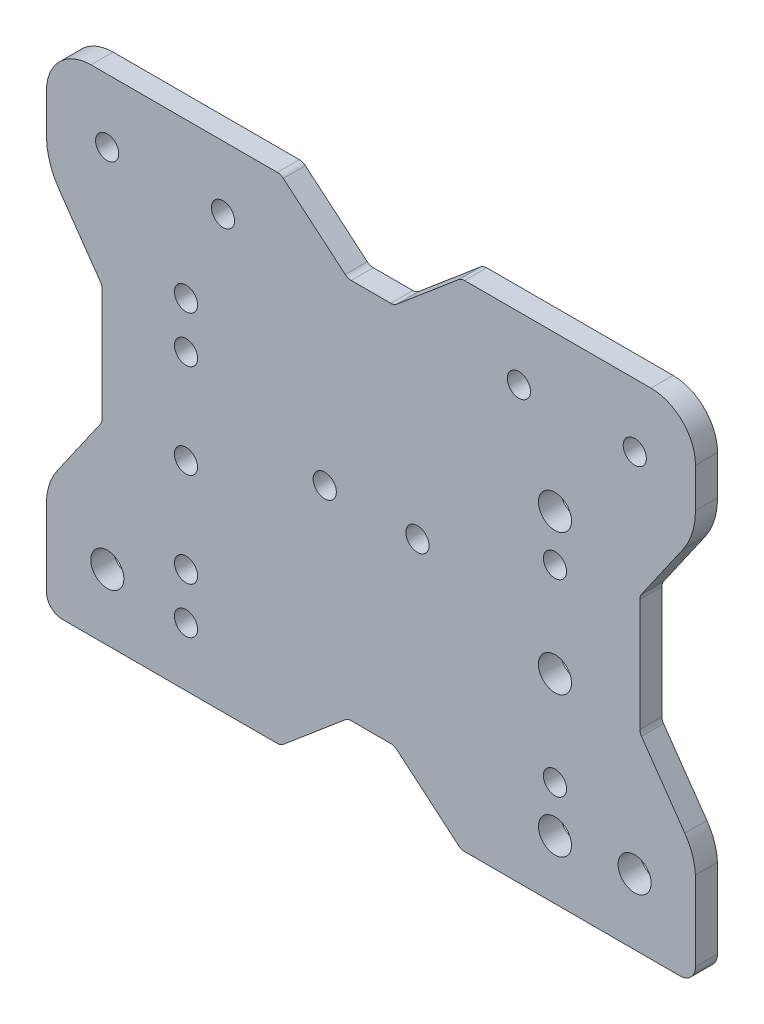
from build123d import *

# Parameters (mm, degrees)
SKETCH2_R           = 2.50063
SKETCH2_R_2         = 3.5687
BOSS_EXTRUDE1_DEPTH = 4.7625


with BuildPart() as part:
    # Sketch2 → Boss-Extrude1 (new body)
    with BuildSketch(Plane.XY):
        with BuildLine():
            Line((20.204627806, -155.317842979), (66.653485088, -155.317842979))
            ThreePointArc((66.653485088, -155.317842979), (69.031331892, -154.332906584), (70.016268288, -151.95505978))
            Line((70.016268288, -151.95505978), (70.009462537, -134.779191139))
            ThreePointArc((70.009462537, -134.779191139), (69.330107736, -131.296239945), (67.723101309, -128.132381176))
            Line((67.723101309, -128.132381176), (58.368571144, -114.709141578))
            ThreePointArc((58.368571144, -114.709141578), (58.101227711, -114.164618042), (58.009428426, -113.56499209))
            Line((58.009428426, -113.56499209), (58.017340801, -89.273956224))
            ThreePointArc((58.017340801, -89.273956224), (58.109330305, -88.675027543), (58.376464494, -88.131136967))
            Line((58.376464494, -88.131136967), (67.309788153, -75.311850981))
            ThreePointArc((67.309788153, -75.311850981), (69.324850125, -71.208346949), (70.017816939, -66.689606297))
            Line((70.017816939, -66.689606297), (70.017970953, -58.209892985))
            ThreePointArc((70.017970953, -58.209892985), (67.203843889, -51.415989261), (60.409940165, -48.601862197))
            Line((60.409940165, -48.601862197), (20.204627806, -48.601862197))
            ThreePointArc((20.204627806, -48.601862197), (19.517944941, -48.72344088), (18.914748074, -49.073395554))
            Line((18.914748074, -49.073395554), (5.555020387, -60.347728592))
            ThreePointArc((5.555020387, -60.347728592), (4.951823521, -60.697683266), (4.265140655, -60.819261949))
            Line((4.265140655, -60.819261949), (-4.272604079, -60.819261949))
            ThreePointArc((-4.272604079, -60.819261949), (-4.959286944, -60.697683266), (-5.562483811, -60.347728592))
            Line((-5.562483811, -60.347728592), (-18.922211498, -49.073395554))
            ThreePointArc((-18.922211498, -49.073395554), (-19.525408364, -48.72344088), (-20.212091229, -48.601862197))
            Line((-20.212091229, -48.601862197), (-60.417403588, -48.601862197))
            ThreePointArc((-60.417403588, -48.601862197), (-67.211307313, -51.415989261), (-70.025434377, -58.209892985))
            Line((-70.025434377, -58.209892985), (-70.025280362, -66.689606297))
            ThreePointArc((-70.025280362, -66.689606297), (-69.332313549, -71.208346949), (-67.317251577, -75.311850981))
            Line((-67.317251577, -75.311850981), (-58.383927917, -88.131136967))
            ThreePointArc((-58.383927917, -88.131136967), (-58.116793729, -88.675027543), (-58.024804225, -89.273956224))
            Line((-58.024804225, -89.273956224), (-58.01689185, -113.56499209))
            ThreePointArc((-58.01689185, -113.56499209), (-58.108691135, -114.164618042), (-58.376034568, -114.709141578))
            Line((-58.376034568, -114.709141578), (-67.730564733, -128.132381176))
            ThreePointArc((-67.730564733, -128.132381176), (-69.337571159, -131.296239945), (-70.016925961, -134.779191139))
            Line((-70.016925961, -134.779191139), (-70.023731711, -151.95505978))
            ThreePointArc((-70.023731711, -151.95505978), (-69.038795316, -154.332906584), (-66.660948512, -155.317842979))
            Line((-66.660948512, -155.317842979), (-20.212091229, -155.317842979))
            ThreePointArc((-20.212091229, -155.317842979), (-19.525408364, -155.196264296), (-18.922211498, -154.846309622))
            Line((-18.922211498, -154.846309622), (-5.562483811, -143.571976584))
            ThreePointArc((-5.562483811, -143.571976584), (-4.959286944, -143.22202191), (-4.272604079, -143.100443227))
            Line((-4.272604079, -143.100443227), (4.265140655, -143.100443227))
            ThreePointArc((4.265140655, -143.100443227), (4.951823521, -143.22202191), (5.555020387, -143.571976584))
            Line((5.555020387, -143.571976584), (18.914748074, -154.846309622))
            ThreePointArc((18.914748074, -154.846309622), (19.517944941, -155.196264296), (20.204627806, -155.317842979))
        make_face()
        with Locations((-56.926856711, -62.252536918)):
            Circle(SKETCH2_R, mode=Mode.SUBTRACT)
        with Locations((-31.926856712, -62.252536918)):
            Circle(SKETCH2_R, mode=Mode.SUBTRACT)
        with Locations((31.919393288, -62.252536918)):
            Circle(SKETCH2_R, mode=Mode.SUBTRACT)
        with Locations((56.919393288, -62.252536918)):
            Circle(SKETCH2_R, mode=Mode.SUBTRACT)
        with Locations((-39.920054199, -81.992843779)):
            Circle(SKETCH2_R, mode=Mode.SUBTRACT)
        with Locations((-39.907032742, -91.992843779)):
            Circle(SKETCH2_R, mode=Mode.SUBTRACT)
        with Locations((-39.920054199, -112.317382635)):
            Circle(SKETCH2_R, mode=Mode.SUBTRACT)
        with Locations((-39.907032742, -132.632843676)):
            Circle(SKETCH2_R, mode=Mode.SUBTRACT)
        with Locations((-39.920054199, -142.632843676)):
            Circle(SKETCH2_R, mode=Mode.SUBTRACT)
        with Locations((10.02542097, -101.992843779)):
            Circle(SKETCH2_R, mode=Mode.SUBTRACT)
        with Locations((-9.97457903, -101.992843779)):
            Circle(SKETCH2_R, mode=Mode.SUBTRACT)
        with Locations((39.700429549, -91.992843779)):
            Circle(SKETCH2_R, mode=Mode.SUBTRACT)
        with Locations((39.700429549, -132.632843676)):
            Circle(SKETCH2_R, mode=Mode.SUBTRACT)
        with Locations((-56.895356292, -141.122536917)):
            Circle(SKETCH2_R_2, mode=Mode.SUBTRACT)
        with Locations((39.700429549, -142.632843676)):
            Circle(SKETCH2_R_2, mode=Mode.SUBTRACT)
        with Locations((39.700429549, -112.317382635)):
            Circle(SKETCH2_R_2, mode=Mode.SUBTRACT)
        with Locations((39.700429549, -81.992843779)):
            Circle(SKETCH2_R_2, mode=Mode.SUBTRACT)
        with Locations((56.887892868, -141.122536917)):
            Circle(SKETCH2_R_2, mode=Mode.SUBTRACT)
    extrude(amount=BOSS_EXTRUDE1_DEPTH)


solid = part.part
